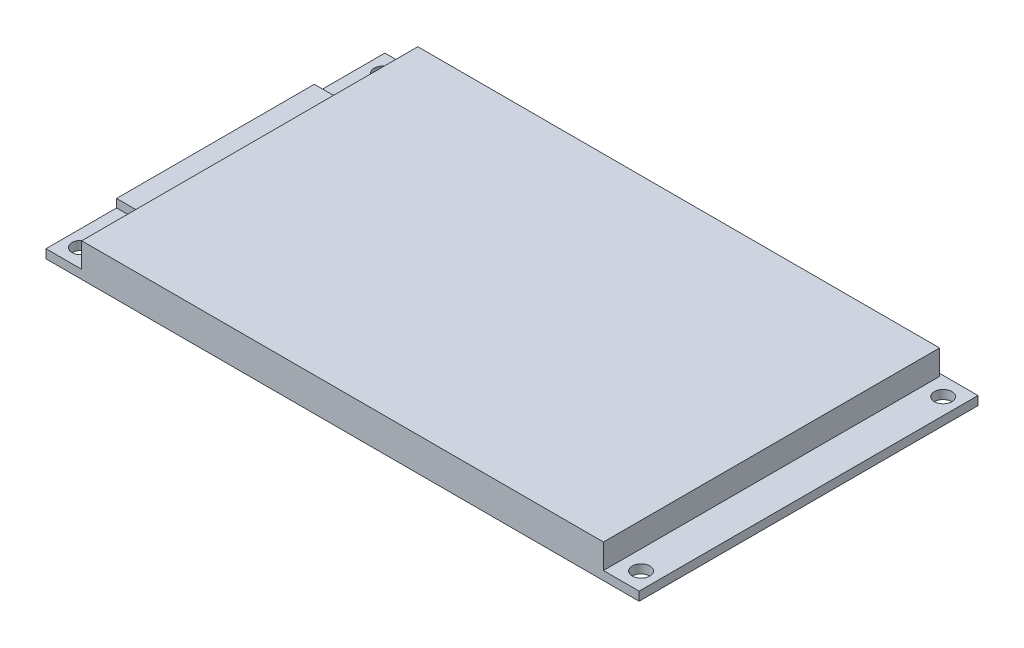
from build123d import *

# Parameters (mm, degrees)
SKETCH_1_W         = 108
SKETCH_1_H         = 61.7
PCB_DEPTH          = 1.6
SKETCH_2_W         = 95
SKETCH_2_H         = 61.2
EXTRUDE_560_DEPTH  = 4.5
SKETCH_4_W         = 3.5
SKETCH_4_H         = 36
EXTRUDE_3_DEPTH    = 1.5
EXTRUDE_START      = -1.6
SKETCH_4_2_W       = 3.5
SKETCH_4_2_H       = 36
EXTRUDE_4_DEPTH    = 8.5
HOLE_WIZARD_M3_1_D = 3.2


with BuildPart() as part:
    # 草图1 → PCB (new body)
    with BuildSketch(Plane(origin=(0, 0, 0), x_dir=(1, 0, 0), z_dir=(0, 1, 0))):
        Rectangle(SKETCH_1_W, SKETCH_1_H)
    extrude(amount=PCB_DEPTH)

    # 草图2 → Extrude 560 (add)
    with BuildSketch(Plane(origin=(0, 1.6, 0), x_dir=(1, 0, 0), z_dir=(0, 1, 0))):
        with Locations((0, -0.25)):
            Rectangle(SKETCH_2_W, SKETCH_2_H)
    extrude(amount=EXTRUDE_560_DEPTH)

    # 草图4 → 凸台-拉伸3 (add)
    with BuildSketch(Plane(origin=(0, 1.6, 0), x_dir=(1, 0, 0), z_dir=(0, 1, 0))):
        with Locations((-52.25, 0)):
            Rectangle(SKETCH_4_W, SKETCH_4_H)
    extrude(amount=EXTRUDE_3_DEPTH)

    # 草图4<2> → 凸台-拉伸4 (add)
    with BuildSketch(Plane(origin=(0, 1.6, 0), x_dir=(1, 0, 0), z_dir=(0, 1, 0)).offset(EXTRUDE_START)):
        with Locations((-52.25, 0)):
            Rectangle(SKETCH_4_2_W, SKETCH_4_2_H)
    extrude(amount=-EXTRUDE_4_DEPTH)

    # M3 间隙孔1 (through all)
    with Locations(Plane(origin=(0, 1.6, 0), x_dir=(1, 0, 0), z_dir=(0, 1, 0))):
        with Locations((-51, 27.5), (-51, -27.5), (51, 27.5), (51, -27.5)):
            Hole(HOLE_WIZARD_M3_1_D / 2)


solid = part.part
